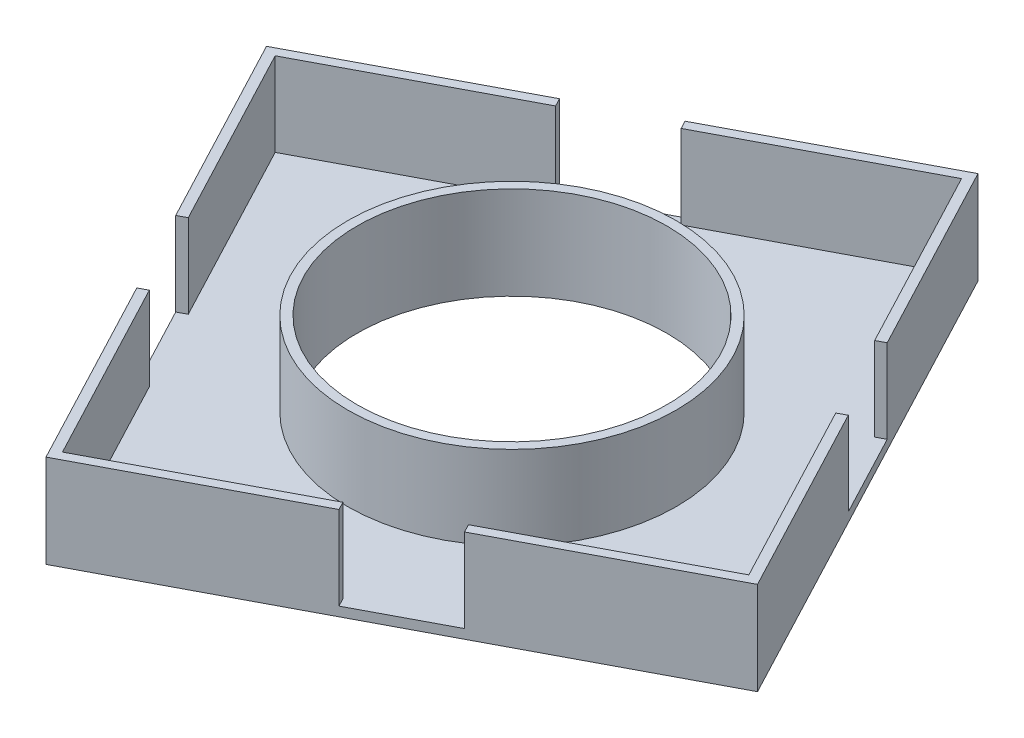
from build123d import *

# Parameters (mm, degrees)
SKETCH2_R           = 50
BOSS_EXTRUDE1_DEPTH = 30
SHELL1_T            = -3
CUT_EXTRUDE3_DEPTH  = 27


with BuildPart() as part:
    # Sketch2 → Boss-Extrude1 (new body)
    with BuildSketch(Plane(origin=(0, 0, 0), x_dir=(1, 0, 0), z_dir=(0, 1, 0))):
        Polygon((-35.583006561, -114.820946016), (114.820946016, -35.583006561), (35.583006561, 114.820946016), (-114.820946016, 35.583006561), align=None)
        with Locations(Location((0, 0, 0), (0, 0, 270))):
            Circle(SKETCH2_R, mode=Mode.SUBTRACT)
    extrude(amount=BOSS_EXTRUDE1_DEPTH)

    # Shell1
    shell1_openings = [part.faces().sort_by_distance(p)[0] for p in [
        (38.105232938, 30, 72.328706262),
    ]]
    offset(amount=SHELL1_T, openings=shell1_openings, kind=Kind.INTERSECTION)

    # Sketch7 → Cut-Extrude3 (cut)
    with BuildSketch(Plane(origin=(0, 30, 0), x_dir=(1, 0, 0), z_dir=(0, 1, 0))):
        Polygon((79.539371783, 24.949716157), (82.193559182, 26.348032736), (68.210393395, 52.88990672), (65.556205997, 51.491590141), align=None)
        Polygon((51.491590141, -65.556205997), (24.949716157, -79.539371783), (26.348032736, -82.193559182), (52.88990672, -68.210393395), align=None)
        Polygon((-65.556205997, -51.491590141), (-79.539371783, -24.949716157), (-82.193559182, -26.348032736), (-68.210393395, -52.88990672), align=None)
        Polygon((-51.491590141, 65.556205997), (-24.949716157, 79.539371783), (-26.348032736, 82.193559182), (-52.88990672, 68.210393395), align=None)
    extrude(amount=-CUT_EXTRUDE3_DEPTH, mode=Mode.SUBTRACT)


solid = part.part
